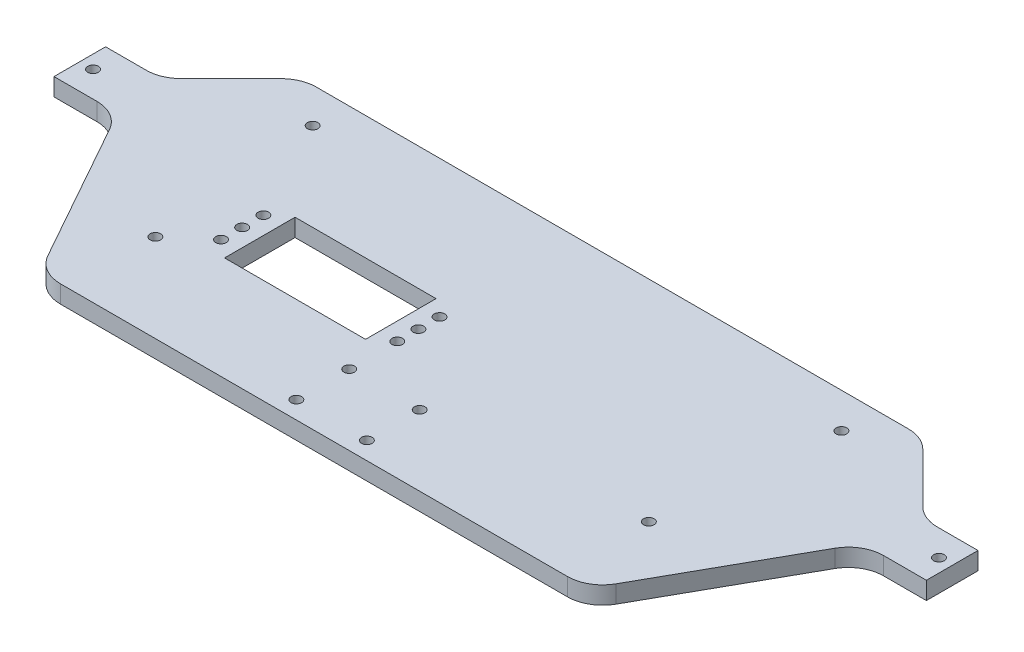
from build123d import *

# Parameters (mm, degrees)
SALIENTE_EXTRUIR1_DEPTH = 5
REDONDEO1_R             = 10
CROQUIS2_R              = 1.5
CROQUIS2_W              = 40
CROQUIS2_H              = 20
CORTAR_EXTRUIR1_DEPTH   = 135.669558943
CROQUIS3_W              = 4
CROQUIS3_H              = 14.636342218
CORTAR_EXTRUIR2_DEPTH   = 135.669558943


with BuildPart() as part:
    # Croquis1 → Saliente-Extruir1 (new body)
    with BuildSketch(Plane(origin=(0, 0, 0), x_dir=(1, 0, 0), z_dir=(0, 1, 0))):
        Polygon((-88.1, 42.318171109), (88.1, 42.318171109), (108.1, 22.318171109), (127.75, 22.318171109), (127.75, 7.681828891), (105.75, 7.681828891), (77.75, -42.318171109), (-77.75, -42.318171109), (-105.75, 7.681828891), (-127.75, 7.681828891), (-127.75, 22.318171109), (-108.1, 22.318171109), align=None)
    extrude(amount=SALIENTE_EXTRUIR1_DEPTH)

    # Redondeo1
    redondeo1_edges = [part.edges().sort_by_distance(p)[0] for p in [
        (-88.1, 2.5, -42.318171109),
        (88.1, 2.5, -42.318171109),
        (108.1, 2.5, -22.318171109),
        (105.75, 2.5, -7.681828891),
        (77.75, 2.5, 42.318171109),
        (-77.75, 2.5, 42.318171109),
        (-105.75, 2.5, -7.681828891),
        (-108.1, 2.5, -22.318171109),
    ]]
    fillet(redondeo1_edges, radius=REDONDEO1_R)

    # Croquis2 → Cortar-Extruir1 (cut, through all)
    with BuildSketch(Plane(origin=(0, 5, 0), x_dir=(1, 0, 0), z_dir=(0, 1, 0))):
        with Locations(Location((70, -17.318171109, 0), (0, 0, 270))):
            Circle(CROQUIS2_R)
        with Locations(Location((-70, -17.318171109, 0), (0, 0, 270))):
            Circle(CROQUIS2_R)
        with Locations(Location((-119.996067812, 15, 0), (0, 0, 270))):
            Circle(CROQUIS2_R)
        with Locations(Location((119.996067812, 15, 0), (0, 0, 270))):
            Circle(CROQUIS2_R)
        with Locations(Location((-75, 32.318171109, 0), (0, 0, 270))):
            Circle(CROQUIS2_R)
        with Locations(Location((75, 32.318171109, 0), (0, 0, 270))):
            Circle(CROQUIS2_R)
        with Locations(Location((-10, -22.318171109, 0), (0, 0, 270))):
            Circle(CROQUIS2_R)
        with Locations(Location((10, -22.318171109, 0), (0, 0, 270))):
            Circle(CROQUIS2_R)
        with Locations(Location((-10, -37.318171109, 0), (0, 0, 270))):
            Circle(CROQUIS2_R)
        with Locations(Location((10, -37.318171109, 0), (0, 0, 270))):
            Circle(CROQUIS2_R)
        with Locations(Location((-60, -2.681828891, 0), (0, 0, 270))):
            Circle(CROQUIS2_R)
        with Locations(Location((-10, -2.681828891, 0), (0, 0, 270))):
            Circle(CROQUIS2_R)
        with Locations(Location((-60, 3.318171109, 0), (0, 0, 270))):
            Circle(CROQUIS2_R)
        with Locations(Location((-60, -8.681828891, 0), (0, 0, 270))):
            Circle(CROQUIS2_R)
        with Locations(Location((-10, 3.318171109, 0), (0, 0, 270))):
            Circle(CROQUIS2_R)
        with Locations(Location((-10, -8.681828891, 0), (0, 0, 270))):
            Circle(CROQUIS2_R)
        with Locations((-35, -2.681828891)):
            Rectangle(CROQUIS2_W, CROQUIS2_H)
    extrude(amount=-CORTAR_EXTRUIR1_DEPTH, mode=Mode.SUBTRACT)

    # Croquis3 → Cortar-Extruir2 (cut, through all)
    with BuildSketch(Plane(origin=(0, 5, 0), x_dir=(1, 0, 0), z_dir=(0, 1, 0))):
        with Locations((-125.75, 15)):
            Rectangle(CROQUIS3_W, CROQUIS3_H)
        with Locations((125.75, 15)):
            Rectangle(CROQUIS3_W, CROQUIS3_H)
    extrude(amount=-CORTAR_EXTRUIR2_DEPTH, mode=Mode.SUBTRACT)


solid = part.part
